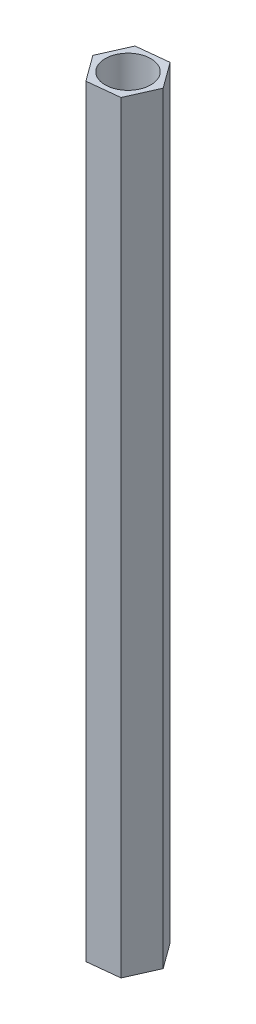
from build123d import *

# Parameters (mm, degrees)
SKETCH1_R           = 1.65
BOSS_EXTRUDE1_DEPTH = 55.15


with BuildPart() as part:
    # Sketch1 → Boss-Extrude1 (new body)
    with BuildSketch(Plane(origin=(0, 0, 0), x_dir=(1, 0, 0), z_dir=(0, 1, 0))):
        Polygon((1.361695707, -1.865239431), (2.296192585, 0.246643358), (0.934496878, 2.11188279), (-1.361695707, 1.865239431), (-2.296192585, -0.246643358), (-0.934496878, -2.11188279), align=None)
        with Locations(Location((0, 0, 0), (0, 0, 270))):
            Circle(SKETCH1_R, mode=Mode.SUBTRACT)
    extrude(amount=BOSS_EXTRUDE1_DEPTH)


solid = part.part
